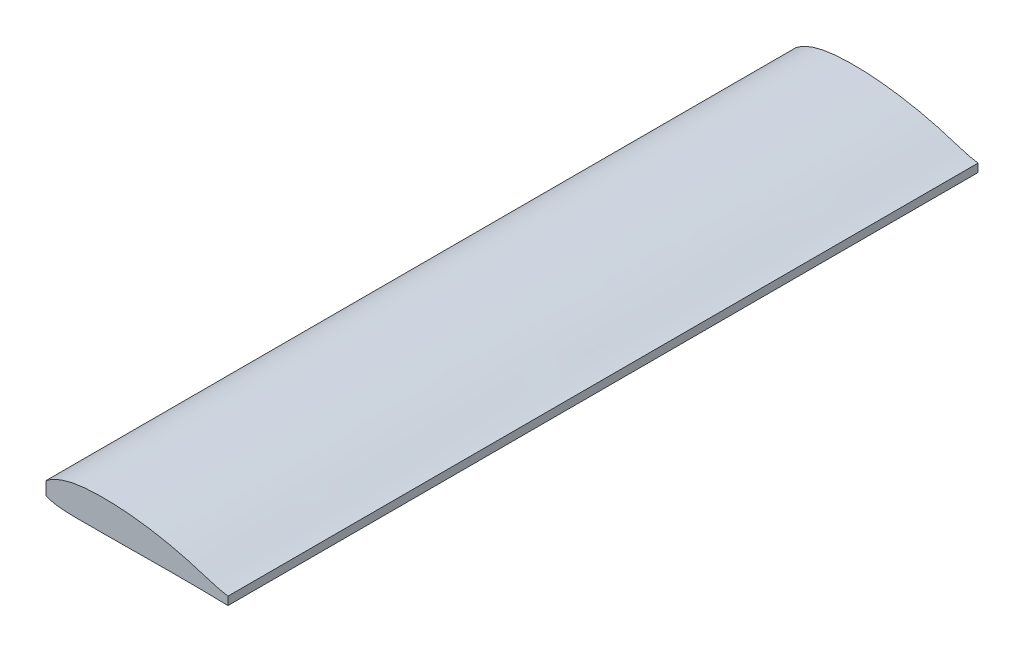
from build123d import *

# Parameters (mm, degrees)
CUERPOPRINCIPAL_DEPTH      = 450
CUERPOPRINCIPAL_DEPTH_BACK = 450
CROQUIS3_W                 = 1.637949446
CROQUIS3_H                 = 900
REDONDEO_DEPTH             = 479.614524078


with BuildPart() as part:
    # Croquis1 → CuerpoPrincipal (new, two sides: drawn at the far end of the back side and taken through both)
    with BuildSketch(Plane.XY.offset(-CUERPOPRINCIPAL_DEPTH_BACK)):
        with BuildLine():
            Line((-63.454075776, -9.255983256), (-63.454075776, 3.956272273))
            add(Edge.make_bspline(
                [(-63.454075776, 3.956272273), (-47.494770498, 17.386808244), (12.462464653, 27.223183656), (97.043288629, 13.204871511), (145.154884918, -4.086730905), (156.545924224, -5.592190829)],
                knots=[0, 0, 0, 0, 0.319356692, 0.833458656, 1, 1, 1, 1], degree=3))
            Line((156.545924224, -5.592190829), (156.545924224, -15.444869207))
            add(Edge.make_bspline(
                [(156.545924224, -15.444869207), (100.614002118, -13.787583975), (10.600254408, -16.03866831), (-54.03514446, -15.065472977), (-63.454075776, -9.255983256)],
                knots=[0, 0, 0, 0, 0.768100549, 1, 1, 1, 1], degree=3))
        make_face()
    extrude(amount=CUERPOPRINCIPAL_DEPTH + CUERPOPRINCIPAL_DEPTH_BACK)

    # Croquis3 → Redondeo (cut, through all)
    with BuildSketch(Plane(origin=(0, 30, 0), x_dir=(1, 0, 0), z_dir=(0, 1, 0))):
        with Locations((-62.635101053, 0)):
            Rectangle(CROQUIS3_W, CROQUIS3_H)
    extrude(amount=-REDONDEO_DEPTH, mode=Mode.SUBTRACT)


solid = part.part
